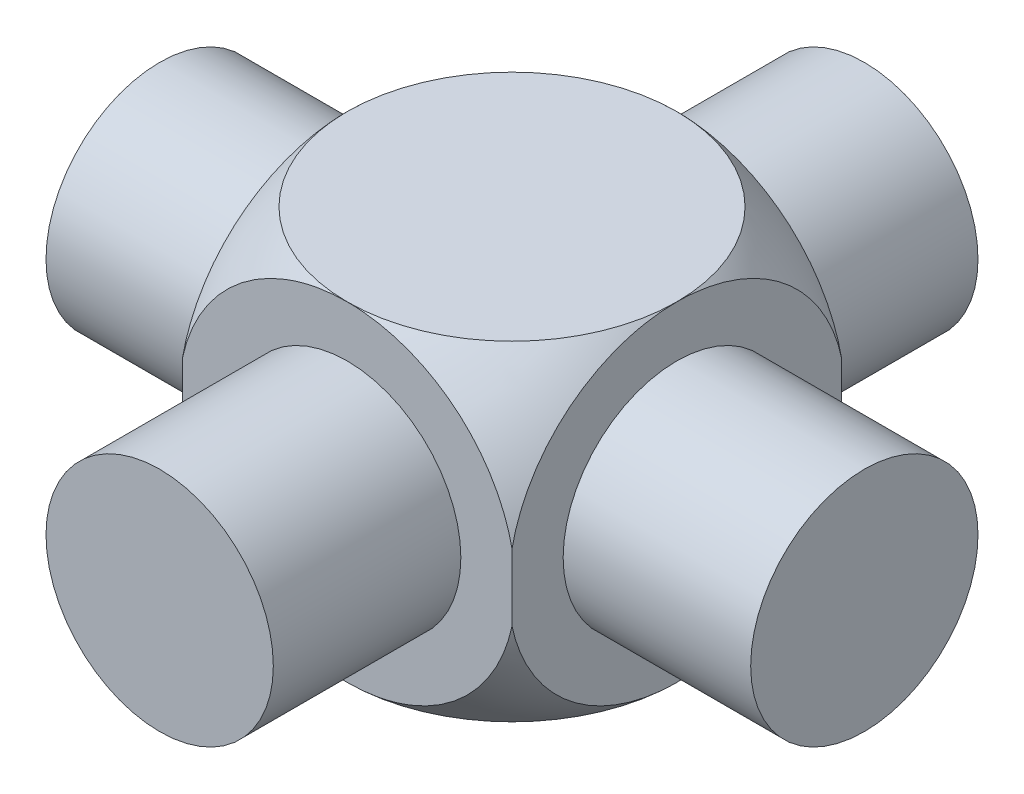
from build123d import *

# Parameters (mm, degrees)
SKETCH1_W           = 14.5
SKETCH1_H           = 14.5
BOSS_EXTRUDE1_DEPTH = 14.5
SKETCH6_R           = 5
BOSS_EXTRUDE2_DEPTH = 15.5
SKETCH7_R           = 5
BOSS_EXTRUDE3_DEPTH = 15.5


with BuildPart() as part:
    # Sketch1 → Boss-Extrude1 (new body)
    with BuildSketch(Plane.XY):
        Rectangle(SKETCH1_W, SKETCH1_H)
    extrude(amount=BOSS_EXTRUDE1_DEPTH)

    # Sketch5 → Cut-Revolve1 (revolve, cut)
    with BuildSketch(Plane(origin=(3.625, 0, 3.625), x_dir=(-0.7071067811865477, 0, 0.7071067811865475), z_dir=(-0.7071067811865475, 0, -0.7071067811865477))):
        with BuildLine():
            Line((12.376524164, 7.25), (16.846797481, 7.25))
            Line((16.846797481, 7.25), (16.846797481, -7.25))
            Line((16.846797481, -7.25), (12.376524164, -7.25))
            ThreePointArc((12.376524164, -7.25), (15.489035507, 0), (12.376524164, 7.25))
        make_face()
    revolve(axis=Axis((0, 7.25, 7.25), (0, -1, 0)), mode=Mode.SUBTRACT)

    # Sketch6 → Boss-Extrude2 (add, symmetric)
    with BuildSketch(Plane(origin=(0, 0, 0), x_dir=(0, 0, -1), z_dir=(1, 0, 0))):
        with Locations(Location((-7.25, 0, 0), (0, 0, 180))):
            Circle(SKETCH6_R)
    extrude(amount=BOSS_EXTRUDE2_DEPTH, both=True)

    # Sketch7 → Boss-Extrude3 (add, symmetric)
    with BuildSketch(Plane(origin=(0, 0, 7.25), x_dir=(-1, 0, 0), z_dir=(0, 0, -1))):
        Circle(SKETCH7_R)
    extrude(amount=BOSS_EXTRUDE3_DEPTH, both=True)


solid = part.part
